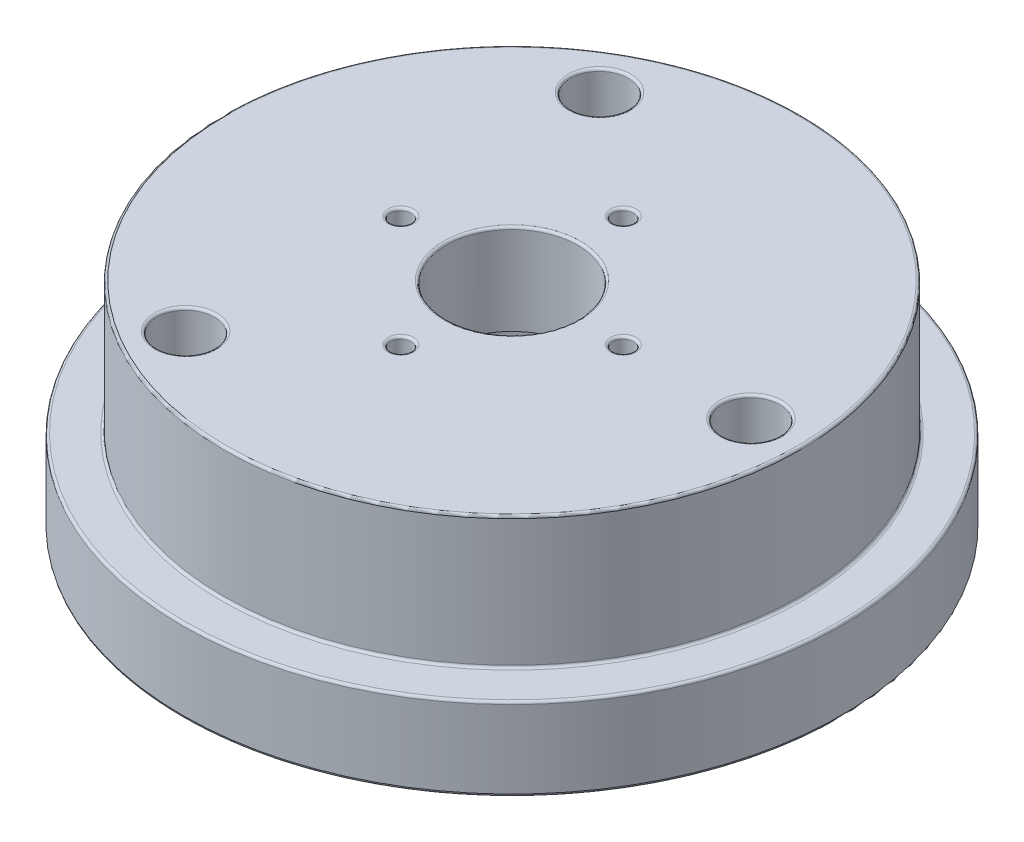
from build123d import *

# Parameters (mm, degrees)
SKETCH2_R          = 1.75
SKETCH2_R_2        = 4
SKETCH2_R_3        = 0.625
CUT_EXTRUDE1_DEPTH = 32.128764833
SKETCH2_3_R        = 10
CUT_EXTRUDE2_DEPTH = 7.5
FILLET1_R          = 0.15


with BuildPart() as part:
    # Sketch1 → Revolve1 (revolve)
    with BuildSketch(Plane.XY):
        Polygon((0, 0), (-20, 0), (-20, 5), (-17.5, 5), (-17.5, 13), (0, 13), align=None)
    revolve(axis=Axis((0, 13, 0), (0, -1, 0)))

    # Sketch2 → Cut-Extrude1 (cut, through all)
    with BuildSketch(Plane.XZ):
        with Locations((14.5, 0)):
            Circle(SKETCH2_R)
        with Locations((-7.25, -12.557368355)):
            Circle(SKETCH2_R)
        with Locations((-7.25, 12.557368355)):
            Circle(SKETCH2_R)
        Circle(SKETCH2_R_2)
        with Locations((6.75, 0)):
            Circle(SKETCH2_R_3)
        with Locations((0, -6.75)):
            Circle(SKETCH2_R_3)
        with Locations((-6.75, 0)):
            Circle(SKETCH2_R_3)
        with Locations((0, 6.75)):
            Circle(SKETCH2_R_3)
    extrude(amount=-CUT_EXTRUDE1_DEPTH, mode=Mode.SUBTRACT)

    # Sketch2<3> → Cut-Extrude2 (cut)
    with BuildSketch(Plane.XZ):
        Circle(SKETCH2_3_R)
    extrude(amount=-CUT_EXTRUDE2_DEPTH, mode=Mode.SUBTRACT)

    # Fillet1
    fillet1_edges = [part.edges().sort_by_distance(p)[0] for p in [
        (17.5, 13, 0),
        (-0.625, 13, 6.75),
        (-0.625, 13, -6.75),
        (-7.375, 13, 0),
        (-4, 13, 0),
        (6.125, 13, 0),
        (12.75, 13, 0),
        (-9, 13, 12.557368355),
        (-9, 13, -12.557368355),
        (17.5, 5, 0),
        (20, 5, 0),
        (20, 0, 0),
        (12.75, 0, 0),
        (-9, 0, 12.557368355),
        (-9, 0, -12.557368355),
        (-10, 0, 0),
    ]]
    fillet(fillet1_edges, radius=FILLET1_R)


solid = part.part
